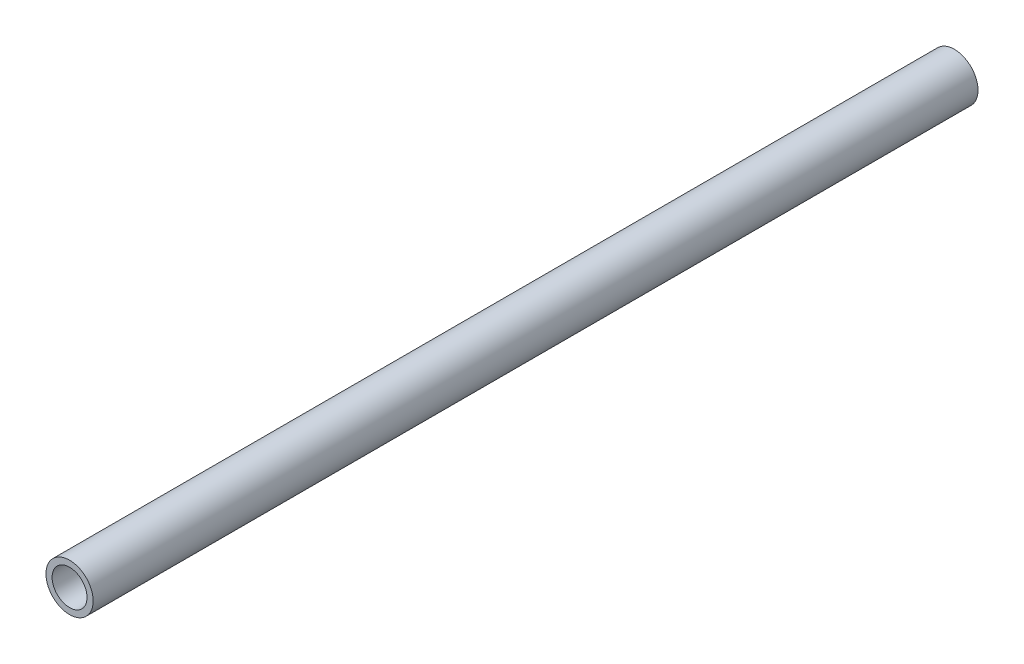
from build123d import *

# Parameters (mm, degrees)
SKETCH1_R           = 10.668
SKETCH1_R_2         = 7.8994
EXTRUDE_THIN1_DEPTH = 200


with BuildPart() as part:
    # Sketch1 → Extrude-Thin1 (new, symmetric)
    with BuildSketch(Plane.XY):
        Circle(SKETCH1_R)
        Circle(SKETCH1_R_2, mode=Mode.SUBTRACT)
    extrude(amount=EXTRUDE_THIN1_DEPTH, both=True)


solid = part.part
